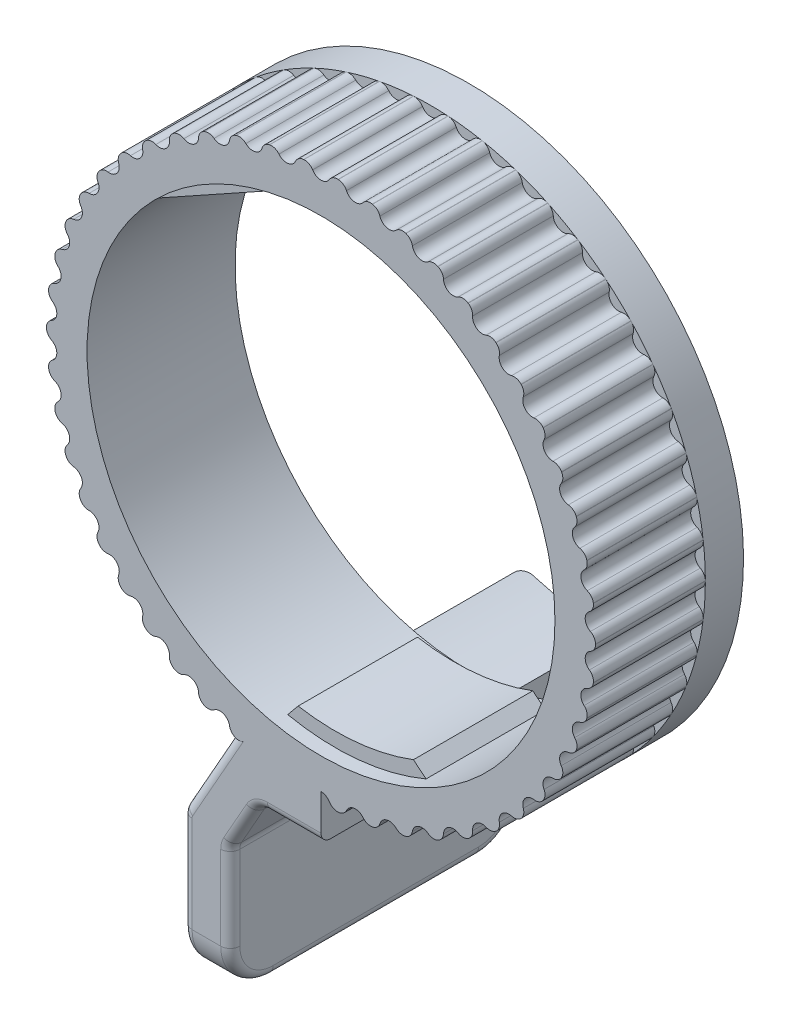
from build123d import *

# Parameters (mm, degrees)
SKETCH1_R           = 14.605
SKETCH1_R_2         = 12.446
BASE_EXTRUDE_DEPTH  = 3.937
BOSS_EXTRUDE3_DEPTH = 3.175
BOSS_EXTRUDE6_DEPTH = 3.175
CUT_EXTRUDE1_DEPTH  = 5.842
CIRPATTERN1_COUNT   = 50
BOSS_EXTRUDE4_DEPTH = 7.874
BOSS_EXTRUDE5_DEPTH = 7.62
FILLET1_R           = 2.286
FILLET2_R           = 0.762
FILLET5_R           = 0.508


with BuildPart() as part:
    # Sketch1 → Base-Extrude (new, symmetric)
    with BuildSketch(Plane.XY):
        Circle(SKETCH1_R)
        Circle(SKETCH1_R_2, mode=Mode.SUBTRACT)
    extrude(amount=BASE_EXTRUDE_DEPTH, both=True)

    # Sketch5 → Boss-Extrude3 (add, symmetric)
    with BuildSketch(Plane.XY):
        with BuildLine():
            Line((-2.032, 12.279002077), (-9.357769774, 8.205794346))
            ThreePointArc((-9.357769774, 8.205794346), (-6.048096327, 10.87765815), (-2.032, 12.279002077))
        make_face()
        with BuildLine():
            Line((2.032, 12.279002077), (9.357769774, 8.205794346))
            ThreePointArc((9.357769774, 8.205794346), (6.048096327, 10.87765815), (2.032, 12.279002077))
        make_face()
    extrude(amount=BOSS_EXTRUDE3_DEPTH, both=True)

    # Sketch9 → Boss-Extrude6 (add, symmetric)
    with BuildSketch(Plane.XY):
        with BuildLine():
            Line((-1.978968483, -11.515187352), (-2.531078122, -12.185916442))
            ThreePointArc((-2.531078122, -12.185916442), (1.201663301, -12.387853781), (4.826, -11.472255227))
            Line((4.826, -11.472255227), (4.155270909, -10.920145588))
            ThreePointArc((4.155270909, -10.920145588), (1.128092078, -11.629413754), (-1.978968483, -11.515187352))
        make_face()
    extrude(amount=BOSS_EXTRUDE6_DEPTH, both=True)

    # Sketch2 → Cut-Extrude1 (cut)
    with BuildSketch(Plane.XY.offset(3.937)):
        with BuildLine():
            ThreePointArc((-0.444619656, 14.333998429), (0, 14.0843), (0.444619656, 14.333998429))
            ThreePointArc((0.444619656, 14.333998429), (0.643572333, 14.520075683), (0.910048801, 14.576619505))
            ThreePointArc((0.910048801, 14.576619505), (0, 14.605), (-0.910048801, 14.576619505))
            ThreePointArc((-0.910048801, 14.576619505), (-0.643572333, 14.520075683), (-0.444619656, 14.333998429))
        make_face()
    cut_extrude1 = extrude(amount=-CUT_EXTRUDE1_DEPTH, mode=Mode.SUBTRACT)

    # CirPattern1: Cut-Extrude1 ×50 about axis
    cirpattern1_axis = Axis((0, 0, 0), (0, 0, 1))
    for i in range(1, CIRPATTERN1_COUNT):
        add(cut_extrude1.rotate(cirpattern1_axis, i * 360 / CIRPATTERN1_COUNT), mode=Mode.SUBTRACT)

    # Sketch6 → Boss-Extrude4 (add, through all)
    with BuildSketch(Plane(origin=(0, 0, -3.937), x_dir=(-1, 0, 0), z_dir=(0, 0, -1))):
        with BuildLine():
            Line((0, -12.446), (0, -16.51))
            Line((0, -16.51), (3.302, -16.51))
            Line((3.302, -16.51), (4.826, -19.209472627))
            Line((4.826, -19.209472627), (4.826, -26.162))
            Line((4.826, -26.162), (7.366, -26.162))
            Line((7.366, -26.162), (7.366, -18.542))
            Line((7.366, -18.542), (3.620595612, -11.907737124))
            ThreePointArc((3.620595612, -11.907737124), (1.830193945, -12.310698848), (0, -12.446))
        make_face()
    extrude(amount=-BOSS_EXTRUDE4_DEPTH)

    # Sketch7 → Boss-Extrude5 (add)
    with BuildSketch(Plane(origin=(0, 0, -3.937), x_dir=(-1, 0, 0), z_dir=(0, 0, -1))):
        with BuildLine():
            Line((0, -14.605), (0, -16.51))
            Line((0, -16.51), (3.302, -16.51))
            Line((3.302, -16.51), (4.826, -19.209472627))
            Line((4.826, -19.209472627), (4.826, -26.162))
            Line((4.826, -26.162), (7.366, -26.162))
            Line((7.366, -26.162), (7.366, -18.542))
            Line((7.366, -18.542), (4.70397567, -13.826736343))
            ThreePointArc((4.70397567, -13.826736343), (2.383961064, -14.409120537), (0, -14.605))
        make_face()
    extrude(amount=BOSS_EXTRUDE5_DEPTH)

    # Fillet1
    fillet1_edges = [part.edges().sort_by_distance(p)[0] for p in [
        (-6.096, -26.162, 3.937),
        (-6.096, -26.162, -11.557),
    ]]
    fillet(fillet1_edges, radius=FILLET1_R)

    # Fillet2
    fillet2_edges = [part.edges().sort_by_distance(p)[0] for p in [
        (-7.366, -18.542, -3.81),
        (-4.826, -19.209472627, -3.81),
        (-3.302, -16.51, -3.81),
    ]]
    fillet(fillet2_edges, radius=FILLET2_R)

    # Fillet5
    fillet5_edges = [part.edges().sort_by_distance(p)[0] for p in [
        (-1.428571624, -16.51, 3.937),
        (-1.428571624, -16.51, -11.557),
        (-7.366, -21.309120894, -11.557),
        (-7.366, -26.162, -3.81),
        (-7.366, -21.309120894, 3.937),
        (-7.366, -25.492446102, 3.267446102),
        (-7.366, -25.492446102, -10.887446102),
        (-4.826, -26.162, -3.81),
        (-4.826, -25.492446102, 3.267446102),
        (-4.826, -25.492446102, -10.887446102),
        (-4.124128786, -17.966242883, -11.557),
        (-4.124128786, -17.966242883, 3.937),
        (-4.826, -21.642857208, -11.557),
        (-4.826, -21.642857208, 3.937),
        (-5.985766416, -16.097181903, -11.557),
        (-7.340978479, -18.548575268, -11.557),
        (-5.977136488, -16.081895648, 3.937),
        (-7.340978479, -18.548575268, 3.937),
        (-3.241322818, -16.61393461, -11.557),
        (-3.241322818, -16.61393461, 3.937),
        (-4.800978479, -19.216047895, -11.557),
        (-4.800978479, -19.216047895, 3.937),
    ]]
    fillet(fillet5_edges, radius=FILLET5_R)


solid = part.part
